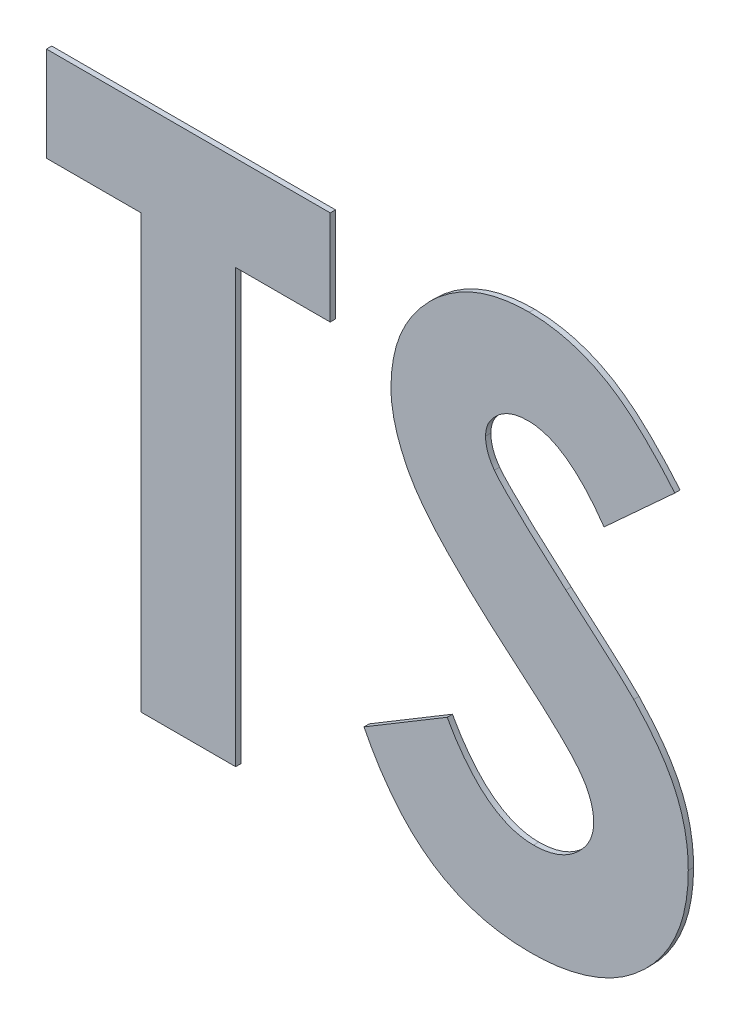
from build123d import *

# Parameters (mm, degrees)
BOSS_EXTRUDE2_DEPTH = 0.1


with BuildPart() as part:
    # Sketch2 → Boss-Extrude2 (new body)
    with BuildSketch(Plane.XY):
        Polygon((-4.551282051, 8.205128205), (-4.551282051, 0), (-2.756410256, 0), (-2.756410256, 8.205128205), (-0.961538462, 8.205128205), (-0.961538462, 10), (-6.346153846, 10), (-6.346153846, 8.205128205), align=None)
        with BuildLine():
            add(Edge.make_bspline(
                [(1.48535153, 0), (1.460838, 0.010341081), (1.365882722, 0.051957676), (1.204347305, 0.133873582), (1.004767059, 0.254125506), (0.813884947, 0.393754262), (0.629286771, 0.549904551), (0.452808355, 0.724978918), (0.28359341, 0.918560312), (0.122758915, 1.13120867), (-0.092314067, 1.442815496), (-0.230504116, 1.697851295), (-0.320512821, 1.872996795)],
                knots=[0.341462315, 0.341462315, 0.341462315, 0.341462315, 0.361230317, 0.418489049, 0.475936712, 0.534203744, 0.594059429, 0.655468694, 0.718771685, 0.784974607, 0.853522316, 1, 1, 1, 1], degree=3))
            Line((1.48535153, 0), (4.178150333, 0))
            add(Edge.make_bspline(
                [(5.833333333, 2.590144231), (5.836556379, 2.39177757), (5.807396557, 2.099692324), (5.723575496, 1.723504993), (5.628862822, 1.461460195), (5.51323848, 1.210595134), (5.368337987, 0.974811142), (5.198159092, 0.75172373), (5.003111445, 0.545320229), (4.787364674, 0.358023886), (4.555955915, 0.191286396), (4.349328922, 0.077208292), (4.220859594, 0.018318592), (4.178150333, 0)],
                knots=[0, 0, 0, 0, 0.127926544, 0.18904691, 0.248543693, 0.307607127, 0.36724766, 0.426963056, 0.488617128, 0.550391855, 0.611330734, 0.672556085, 0.702571181, 0.702571181, 0.702571181, 0.702571181], degree=3))
            add(Edge.make_bspline(
                [(4.799679487, 4.883814103), (4.972046146, 4.70296104), (5.207229977, 4.429216435), (5.459741281, 4.042091474), (5.600250109, 3.765825955), (5.706202322, 3.487069286), (5.807580629, 3.098571269), (5.833539424, 2.794864513), (5.833333333, 2.590144231)],
                knots=[0, 0, 0, 0, 0.289954183, 0.417138648, 0.535255184, 0.648751095, 0.762405462, 1, 1, 1, 1], degree=3))
            add(Edge.make_bspline(
                [(3.51161859, 6.037660256), (3.670834794, 5.899015153), (3.899126567, 5.704240516), (4.182132498, 5.454181599), (4.357136314, 5.300080319), (4.504850468, 5.166660423), (4.650147699, 5.030820488), (4.745616907, 4.939283835), (4.799679487, 4.883814103)],
                knots=[0, 0, 0, 0, 0.366184141, 0.520457298, 0.655012135, 0.770624226, 0.865677185, 1, 1, 1, 1], degree=3))
            add(Edge.make_bspline(
                [(2.153445513, 7.327724359), (2.20461199, 7.259389428), (2.304218944, 7.152286409), (2.457147154, 6.996386214), (2.61452056, 6.847270221), (2.79617707, 6.673533424), (3.099171859, 6.402290717), (3.339999163, 6.187066649), (3.51161859, 6.037660256)],
                knots=[0, 0, 0, 0, 0.136349281, 0.233805212, 0.349411224, 0.48317915, 0.635966856, 1, 1, 1, 1], degree=3))
            add(Edge.make_bspline(
                [(1.987179487, 7.806490385), (1.985948248, 7.722541703), (2.017859782, 7.551251278), (2.101226417, 7.398634388), (2.153445513, 7.327724359)],
                knots=[0, 0, 0, 0, 0.487115475, 1, 1, 1, 1], degree=3))
            add(Edge.make_bspline(
                [(2.796474359, 8.461538462), (2.68723449, 8.461714305), (2.524417496, 8.442214992), (2.333502672, 8.351111674), (2.21199816, 8.264653628), (2.115884267, 8.160406635), (2.014811587, 8.017284715), (1.9881325, 7.88877723), (1.987179487, 7.806490385)],
                knots=[0, 0, 0, 0, 0.285992887, 0.416634394, 0.547379946, 0.671582838, 0.784400739, 1, 1, 1, 1], degree=3))
            add(Edge.make_bspline(
                [(4.234775641, 7.435897436), (4.12736706, 7.593471623), (3.958618898, 7.811040737), (3.70986163, 8.058990936), (3.530965751, 8.205548604), (3.349577267, 8.319578363), (3.110164479, 8.425885094), (2.920733401, 8.461946352), (2.796474359, 8.461538462)],
                knots=[0, 0, 0, 0, 0.31182434, 0.448432767, 0.573381197, 0.689077147, 0.797572901, 1, 1, 1, 1], degree=3))
            Line((4.234775641, 7.435897436), (5.576923077, 8.663862179))
            add(Edge.make_bspline(
                [(2.81650641, 10.256410256), (3.0513038, 10.256292599), (3.403416621, 10.212218251), (3.855042582, 10.070634701), (4.128190391, 9.943420306), (4.345527336, 9.820002318), (4.512096474, 9.706401822), (4.681587602, 9.576257291), (4.855377135, 9.429174971), (5.030196996, 9.262349729), (5.278560846, 9.011944158), (5.458546374, 8.807844761), (5.576923077, 8.663862179)],
                knots=[0, 0, 0, 0, 0.212976528, 0.319776676, 0.428556273, 0.485856803, 0.546558687, 0.611431498, 0.67982091, 0.753158505, 0.830752869, 1, 1, 1, 1], degree=3))
            add(Edge.make_bspline(
                [(0.192307692, 7.720352564), (0.19131912, 7.88910687), (0.216578448, 8.13930841), (0.293923062, 8.461944309), (0.376557185, 8.691675585), (0.483969479, 8.911542905), (0.614375956, 9.122625311), (0.769847066, 9.322979283), (0.945049541, 9.512472357), (1.138078595, 9.68564699), (1.344354539, 9.838492639), (1.562709715, 9.967582214), (1.791809645, 10.074693926), (2.033068803, 10.156597321), (2.373429116, 10.235543149), (2.63819748, 10.255302337), (2.81650641, 10.256410256)],
                knots=[0, 0, 0, 0, 0.12445736, 0.184840915, 0.244566821, 0.304319173, 0.365199786, 0.427420983, 0.491261689, 0.555499002, 0.618604518, 0.680494764, 0.742473305, 0.804990665, 0.868251971, 1, 1, 1, 1], degree=3))
            add(Edge.make_bspline(
                [(2.712339744, 4.210737179), (2.467156852, 4.416370493), (2.118357969, 4.717619446), (1.68447951, 5.115741965), (1.410224639, 5.384601459), (1.169326136, 5.632074114), (0.963388609, 5.860145575), (0.794699819, 6.070581437), (0.617131528, 6.319825882), (0.448753138, 6.623562109), (0.256721231, 7.101050655), (0.189683045, 7.474524767), (0.192307692, 7.720352564)],
                knots=[0, 0, 0, 0, 0.215201009, 0.309902452, 0.395959096, 0.473447494, 0.542140328, 0.602523333, 0.654726333, 0.747804055, 0.835278417, 1, 1, 1, 1], degree=3))
            add(Edge.make_bspline(
                [(4.038461538, 2.485977564), (4.038193412, 2.602203821), (4.003149727, 2.779154786), (3.902059828, 3.003569285), (3.811091696, 3.144877639), (3.71834138, 3.263183969), (3.629680561, 3.365692423), (3.52170512, 3.478945606), (3.394701187, 3.603088004), (3.250338094, 3.739205714), (3.023866562, 3.9464868), (2.840615244, 4.102893683), (2.712339744, 4.210737179)],
                knots=[0, 0, 0, 0, 0.155090822, 0.238351561, 0.32840414, 0.37938386, 0.439617644, 0.509831416, 0.588874645, 0.677436354, 0.77554672, 1, 1, 1, 1], degree=3))
            add(Edge.make_bspline(
                [(2.896634615, 1.538461538), (3.047463771, 1.53731824), (3.269664059, 1.571565235), (3.538566079, 1.692789273), (3.709432682, 1.819011458), (3.853828989, 1.964890474), (3.995392385, 2.178492725), (4.040601083, 2.363899381), (4.038461538, 2.485977564)],
                knots=[0, 0, 0, 0, 0.275473311, 0.404345843, 0.535429711, 0.661427401, 0.77786684, 1, 1, 1, 1], degree=3))
            add(Edge.make_bspline(
                [(1.258012821, 2.820512821), (1.365522326, 2.62415139), (1.540337666, 2.35222131), (1.811389641, 2.040605962), (2.014408695, 1.858490427), (2.224152025, 1.715672647), (2.510931219, 1.579950245), (2.743224957, 1.538145131), (2.896634615, 1.538461538)],
                knots=[0, 0, 0, 0, 0.307611547, 0.442138888, 0.566229194, 0.681222208, 0.789558005, 1, 1, 1, 1], degree=3))
            Line((1.258012821, 2.820512821), (-0.320512821, 1.872996795))
        make_face()
        with BuildLine():
            Line((4.178150333, 0), (1.48535153, 0))
            add(Edge.make_bspline(
                [(2.830528846, -0.256410256), (2.661174485, -0.256281445), (2.410402104, -0.241468047), (2.084880675, -0.187714321), (1.852665495, -0.131016828), (1.653610065, -0.067214648), (1.532603593, -0.019933376), (1.48535153, 0)],
                knots=[0, 0, 0, 0, 0.125868382, 0.18624025, 0.244976651, 0.303357688, 0.341462315, 0.341462315, 0.341462315, 0.341462315], degree=3))
            add(Edge.make_bspline(
                [(4.178150333, 0), (4.133395026, -0.01919617), (3.997065846, -0.073547257), (3.760715706, -0.146970814), (3.358063757, -0.235150464), (3.043584773, -0.256804432), (2.830528846, -0.256410256)],
                knots=[0.702571181, 0.702571181, 0.702571181, 0.702571181, 0.734024191, 0.797340621, 0.862249627, 1, 1, 1, 1], degree=3))
        make_face()
    extrude(amount=BOSS_EXTRUDE2_DEPTH)


solid = part.part
